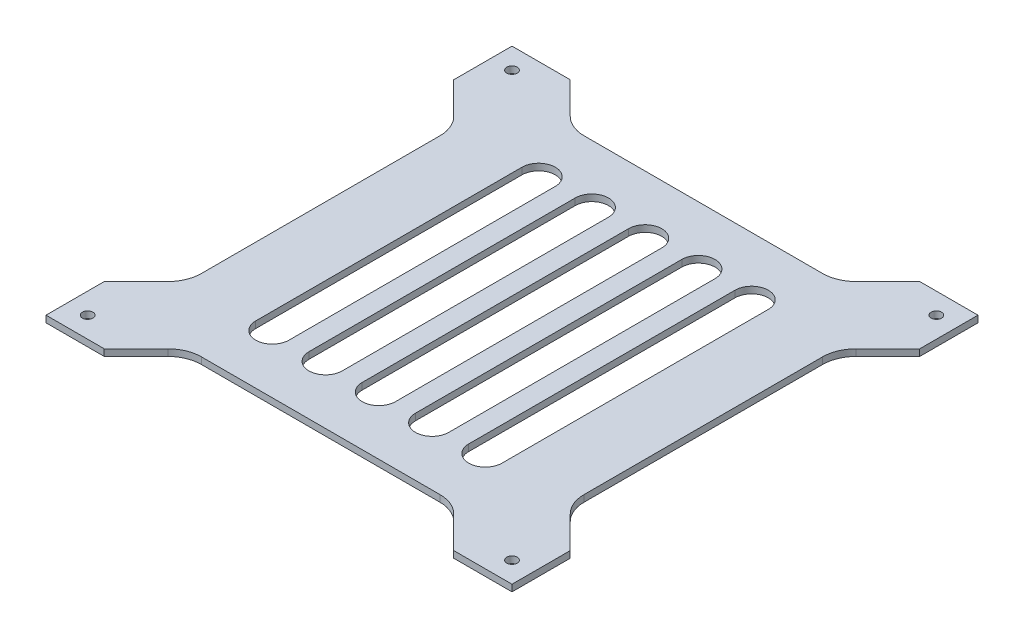
from build123d import *

# Parameters (mm, degrees)
SKETCH_1_R          = 1.569016128
EXTRUDE_1_DEPTH     = 2
FILLET_1_R          = 10
CUT_EXTRUDE_1_DEPTH = 2


with BuildPart() as part:
    # 草图1 → 凸台-拉伸1 (new body)
    with BuildSketch(Plane(origin=(0, 0, 0), x_dir=(1, 0, 0), z_dir=(0, 1, 0))):
        Polygon((-52.5, 70), (-40, 57.5), (40, 57.5), (52.5, 70), (70, 70), (70, 52.5), (57.5, 40), (57.5, -40), (70, -52.5), (70, -70), (52.5, -70), (40, -57.5), (-40, -57.5), (-52.5, -70), (-70, -70), (-70, -52.5), (-57.5, -40), (-57.5, 40), (-70, 52.5), (-70, 70), align=None)
        with Locations(Location((-63.74128019, 63.74128019, 0), (0, 0, 270))):
            Circle(SKETCH_1_R, mode=Mode.SUBTRACT)
        with Locations(Location((63.74128019, 63.74128019, 0), (0, 0, 270))):
            Circle(SKETCH_1_R, mode=Mode.SUBTRACT)
        with Locations(Location((63.74128019, -63.74128019, 0), (0, 0, 270))):
            Circle(SKETCH_1_R, mode=Mode.SUBTRACT)
        with Locations(Location((-63.74128019, -63.74128019, 0), (0, 0, 270))):
            Circle(SKETCH_1_R, mode=Mode.SUBTRACT)
    extrude(amount=EXTRUDE_1_DEPTH)

    # 圆角1
    fillet_1_edges = [part.edges().sort_by_distance(p)[0] for p in [
        (57.5, 1, -40),
        (57.5, 1, 40),
        (40, 1, 57.5),
        (-40, 1, 57.5),
        (-57.5, 1, 40),
        (-57.5, 1, -40),
        (-40, 1, -57.5),
        (40, 1, -57.5),
    ]]
    fillet(fillet_1_edges, radius=FILLET_1_R)

    # 草图2 → 切除-拉伸1 (cut)
    with BuildSketch(Plane(origin=(0, 2, 0), x_dir=(1, 0, 0), z_dir=(0, 1, 0))):
        with BuildLine():
            Line((-5, -40), (-5, 40))
            ThreePointArc((-5, 40), (0, 45), (5, 40))
            Line((5, 40), (5, -40))
            ThreePointArc((5, -40), (0, -45), (-5, -40))
        make_face()
        with BuildLine():
            Line((11, -40), (11, 40))
            ThreePointArc((11, 40), (16, 45), (21, 40))
            Line((21, 40), (21, -40))
            ThreePointArc((21, -40), (16, -45), (11, -40))
        make_face()
        with BuildLine():
            Line((27, -40), (27, 40))
            ThreePointArc((27, 40), (32, 45), (37, 40))
            Line((37, 40), (37, -40))
            ThreePointArc((37, -40), (32, -45), (27, -40))
        make_face()
        with BuildLine():
            Line((-21, -40), (-21, 40))
            ThreePointArc((-21, 40), (-16, 45), (-11, 40))
            Line((-11, 40), (-11, -40))
            ThreePointArc((-11, -40), (-16, -45), (-21, -40))
        make_face()
        with BuildLine():
            Line((-37, -40), (-37, 40))
            ThreePointArc((-37, 40), (-32, 45), (-27, 40))
            Line((-27, 40), (-27, -40))
            ThreePointArc((-27, -40), (-32, -45), (-37, -40))
        make_face()
    extrude(amount=-CUT_EXTRUDE_1_DEPTH, mode=Mode.SUBTRACT)


solid = part.part
